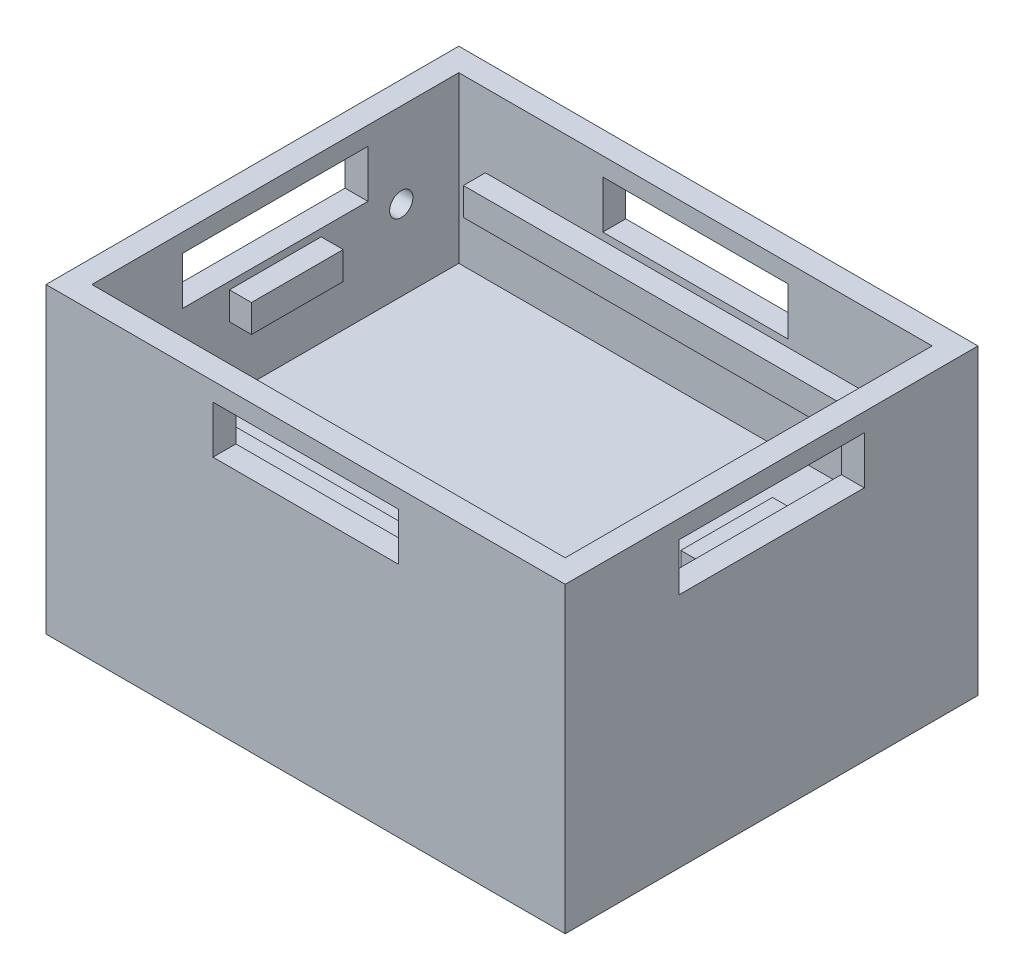
from build123d import *

# Parameters (mm, degrees)
SKETCH1_W                         = 283
SKETCH1_H                         = 225
SKETCH1_W_2                       = 258
SKETCH1_H_2                       = 200
WALLS_DEPTH                       = 90
SKETCH3_W                         = 283
SKETCH3_H                         = 225
BASE_DEPTH                        = 12.5
SKETCH4_W                         = 12
SKETCH4_H                         = 15.1
LONG_SUPPORT_DEPTH                = 114.5
SKETCH5_W                         = 12
SKETCH5_H                         = 15.1
SHORT_SUPPORT_DEPTH               = 25
RESERVOIR_OUTFLOW_TUBE_HOLE_REACH = 359.065
SKETCH6_R                         = 6.35
SKETCH7_W                         = 101
SKETCH7_H                         = 26
CONNECTOR_PORT_SHORTSIDE_DEPTH    = 283
LPATTERN1_COUNT                   = 2
LPATTERN1_PITCH                   = 270.5
SKETCH8_W                         = 101
SKETCH8_H                         = 26
CONNECTOR_PORT_LONGSIDE_DEPTH     = 225
LPATTERN2_COUNT                   = 2
LPATTERN2_PITCH                   = 212.5
SKETCH9_W                         = 283
SKETCH9_H                         = 225
SKETCH9_W_2                       = 258
SKETCH9_H_2                       = 200
LOWER_WATER_JACKET_WALLS_DEPTH    = 50
SKETCH11_W                        = 283
SKETCH11_H                        = 225
LOWER_WATER_JACKET_BOTTOM_DEPTH   = 12.5


with BuildPart() as part:
    # Sketch1 → Walls (new body)
    with BuildSketch(Plane(origin=(0, 0, 0), x_dir=(1, 0, 0), z_dir=(0, 1, 0))):
        with Locations((126.5, 102.5)):
            Rectangle(SKETCH1_W, SKETCH1_H)
        with Locations((126.5, 102.5)):
            Rectangle(SKETCH1_W_2, SKETCH1_H_2, mode=Mode.SUBTRACT)
    extrude(amount=WALLS_DEPTH)

    # Sketch3 → Base (add)
    with BuildSketch(Plane.XZ):
        with Locations((126.5, -102.5)):
            Rectangle(SKETCH3_W, SKETCH3_H)
    extrude(amount=BASE_DEPTH)

    # Sketch4 → Long_Support (add, symmetric)
    with BuildSketch(Plane(origin=(126.5, 0, 0), x_dir=(0, 0, -1), z_dir=(1, 0, 0))):
        with Locations((8.5, 42.45)):
            Rectangle(SKETCH4_W, SKETCH4_H)
        with Locations((196.5, 42.45)):
            Rectangle(SKETCH4_W, SKETCH4_H)
    extrude(amount=LONG_SUPPORT_DEPTH, both=True)

    # Sketch5 → Short_Support (add, symmetric)
    with BuildSketch(Plane(origin=(0, 0, -102.5), x_dir=(-1, 0, 0), z_dir=(0, 0, -1))):
        with Locations((-249.5, 42.45)):
            Rectangle(SKETCH5_W, SKETCH5_H)
        with Locations((-3.5, 42.45)):
            Rectangle(SKETCH5_W, SKETCH5_H)
    extrude(amount=SHORT_SUPPORT_DEPTH, both=True)

    # Sketch6 → Reservoir_Outflow_Tube_Hole (cut, up to next)
    with BuildSketch(Plane(origin=(-2.5, 0, 0), x_dir=(0, 0, -1), z_dir=(1, 0, 0)), mode=Mode.PRIVATE) as reservoir_outflow_tube_hole_sk1:
        with Locations((171.15, 43.65)):
            Circle(SKETCH6_R)
    reservoir_outflow_tube_hole_tool1 = extrude(reservoir_outflow_tube_hole_sk1.sketch, amount=-RESERVOIR_OUTFLOW_TUBE_HOLE_REACH, mode=Mode.PRIVATE) & part.part
    add(reservoir_outflow_tube_hole_tool1.solids().sort_by_distance((-2.5, 43.65, -171.15))[0], mode=Mode.SUBTRACT)

    # Sketch7 → Connector_Port_ShortSide (cut)
    with BuildSketch(Plane(origin=(-2.5, 0, 0), x_dir=(0, 0, -1), z_dir=(1, 0, 0))):
        with Locations((102.5, 67)):
            Rectangle(SKETCH7_W, SKETCH7_H)
    connector_port_shortside = extrude(amount=-CONNECTOR_PORT_SHORTSIDE_DEPTH, mode=Mode.SUBTRACT)

    # LPattern1: Connector_Port_ShortSide ×2
    with Locations(*[(i * LPATTERN1_PITCH, 0, 0) for i in range(1, LPATTERN1_COUNT)]):
        add(connector_port_shortside, mode=Mode.SUBTRACT)

    # Sketch8 → Connector_Port_LongSide (cut)
    with BuildSketch(Plane.XY.offset(-2.5)):
        with Locations((126.5, 67)):
            Rectangle(SKETCH8_W, SKETCH8_H)
    connector_port_longside = extrude(amount=CONNECTOR_PORT_LONGSIDE_DEPTH, mode=Mode.SUBTRACT)

    # LPattern2: Connector_Port_LongSide ×2
    with Locations(*[(0, 0, -i * LPATTERN2_PITCH) for i in range(1, LPATTERN2_COUNT)]):
        add(connector_port_longside, mode=Mode.SUBTRACT)

    # Sketch9 → Lower_Water_Jacket_Walls (add)
    with BuildSketch(Plane.XZ.offset(12.5)):
        with Locations((126.5, -102.5)):
            Rectangle(SKETCH9_W, SKETCH9_H)
        with Locations((126.5, -102.5)):
            Rectangle(SKETCH9_W_2, SKETCH9_H_2, mode=Mode.SUBTRACT)
    extrude(amount=LOWER_WATER_JACKET_WALLS_DEPTH)

    # Sketch11 → Lower_Water_Jacket_Bottom (add)
    with BuildSketch(Plane.XZ.offset(62.5)):
        with Locations((126.5, -102.5)):
            Rectangle(SKETCH11_W, SKETCH11_H)
    extrude(amount=LOWER_WATER_JACKET_BOTTOM_DEPTH)


solid = part.part
